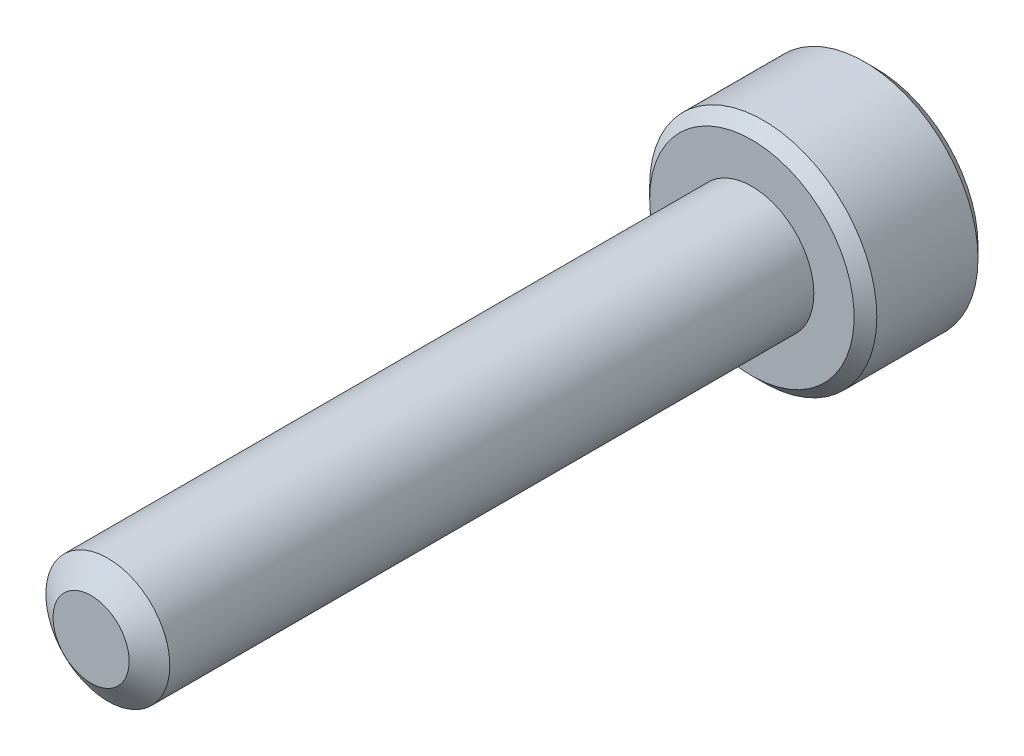
from build123d import *

# Parameters (mm, degrees)
SKETCH1_R          = 1.5
EXTRUDE1_DEPTH     = 16
SKETCH6_R          = 2.75
EXTRUDE2_DEPTH     = 3
CUT_EXTRUDE1_DEPTH = 1.875
CHAMFER1_SIZE      = 0.275


with BuildPart() as part:
    # Sketch1 → Extrude1 (new body)
    with BuildSketch(Plane.XY):
        Circle(SKETCH1_R)
    extrude(amount=-EXTRUDE1_DEPTH)

    # Sketch4 → Cut-Revolve1 (revolve, cut)
    with BuildSketch(Plane(origin=(0, 0, 0), x_dir=(0, 0, -1), z_dir=(1, 0, 0))):
        Polygon((0.405251783, 1.5), (0, 0.921240474), (0, 1.5), align=None)
    revolve(axis=Axis((0, 0, 0), (0, 0, -1)), mode=Mode.SUBTRACT)

    # Sketch6 → Extrude2 (add)
    with BuildSketch(Plane(origin=(0, 0, -16), x_dir=(-1, 0, 0), z_dir=(0, 0, -1))):
        Circle(SKETCH6_R)
    extrude(amount=EXTRUDE2_DEPTH)

    # Sketch7 → Cut-Extrude1 (cut)
    with BuildSketch(Plane(origin=(0, 0, -19), x_dir=(-1, 0, 0), z_dir=(0, 0, -1))):
        Polygon((0, 1.443375673), (-1.25, 0.721687836), (-1.25, -0.721687836), (0, -1.443375673), (1.25, -0.721687836), (1.25, 0.721687836), align=None)
    extrude(amount=-CUT_EXTRUDE1_DEPTH, mode=Mode.SUBTRACT)

    # Cut-Extrude2 cone 1 section (through the dimple's axis) → Cut-Extrude2 (revolve, cut)
    with BuildSketch(Plane(origin=(0, 0, -19), x_dir=(0, 1, 0), z_dir=(1, 0, 0))):
        Polygon((0, 0), (1.443375673, 0), (0, 1.443375673), align=None)
    revolve(axis=Axis((0, 0, -19), (0, 0, 1)), mode=Mode.SUBTRACT)

    # Chamfer1
    chamfer1_edges = [part.edges().sort_by_distance(p)[0] for p in [
        (2.75, 0, -19),
        (2.75, 0, -16),
    ]]
    chamfer(chamfer1_edges, length=CHAMFER1_SIZE)


solid = part.part
